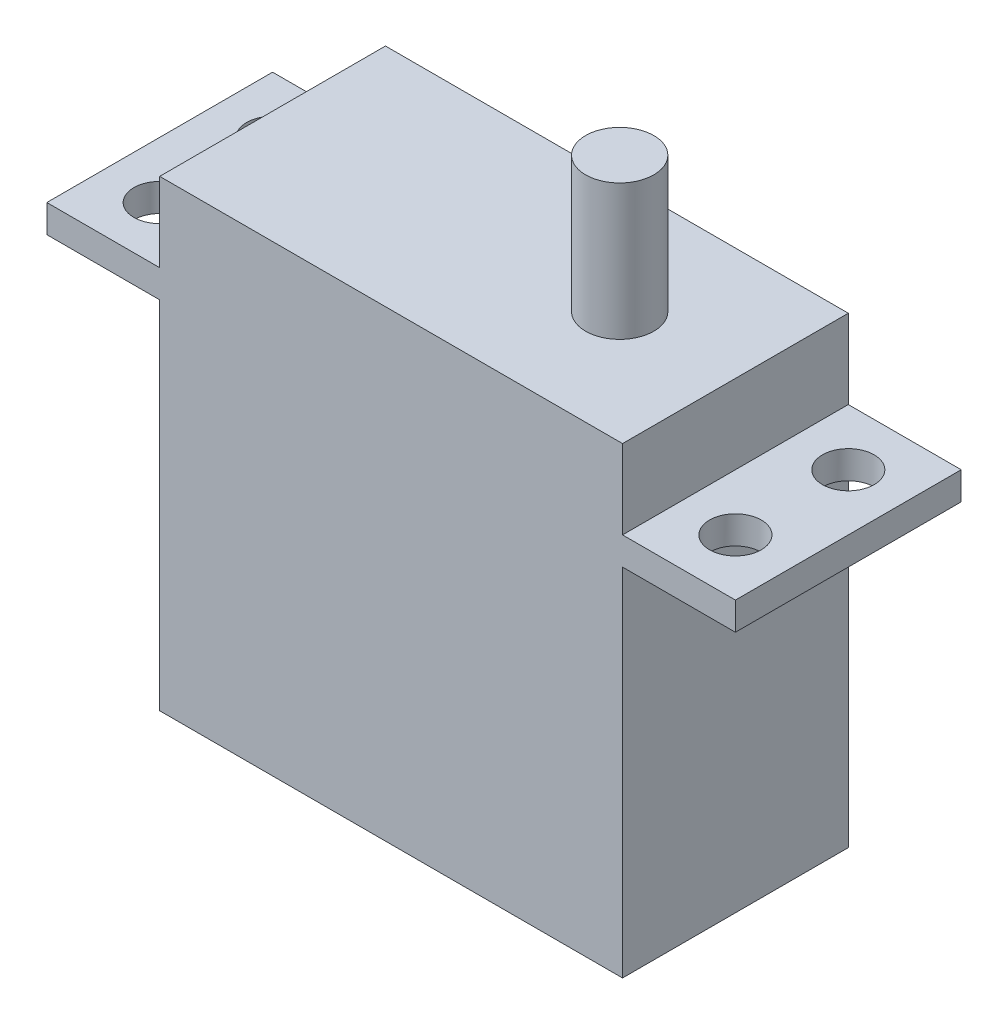
from build123d import *

# Parameters (mm, degrees)
SKETCH1_W           = 20.5
SKETCH1_H           = 20
BOSS_EXTRUDE1_DEPTH = 41
SKETCH3_W           = 20
SKETCH3_H           = 2.467931734
BOSS_EXTRUDE2_DEPTH = 10
SKETCH4_R           = 2.290313936
CUT_EXTRUDE9_DEPTH  = 10
SKETCH5_R           = 3.018718549
BOSS_EXTRUDE3_DEPTH = 12


with BuildPart() as part:
    # Sketch1 → Boss-Extrude1 (new body)
    with BuildSketch(Plane(origin=(0, 0, 0), x_dir=(1, 0, 0), z_dir=(0, 1, 0))):
        Rectangle(SKETCH1_W, SKETCH1_H)
    boss_extrude1 = extrude(amount=BOSS_EXTRUDE1_DEPTH)

    # Sketch3 → Boss-Extrude2 (add)
    with BuildSketch(Plane.ZY.offset(10.25)):
        with Locations((0, 32.759182637)):
            Rectangle(SKETCH3_W, SKETCH3_H)
    boss_extrude2 = extrude(amount=BOSS_EXTRUDE2_DEPTH)

    # Sketch4 → Cut-Extrude9 (cut)
    with BuildSketch(Plane(origin=(0, 33.993148504, 0), x_dir=(1, 0, 0), z_dir=(0, 1, 0))):
        with Locations(Location((-15.25, 5, 0), (0, 0, 270))):
            Circle(SKETCH4_R)
        with Locations(Location((-15.25, -5, 0), (0, 0, 270))):
            Circle(SKETCH4_R)
    cut_extrude9 = extrude(amount=-CUT_EXTRUDE9_DEPTH, mode=Mode.SUBTRACT)

    # Mirror1: Boss-Extrude1, Boss-Extrude2, Cut-Extrude9 across plane
    add(boss_extrude1.mirror(Plane(origin=(10.25, 41, -10), x_dir=(0, 0, 1), z_dir=(-1, 0, 0))))
    add(boss_extrude2.mirror(Plane(origin=(10.25, 41, -10), x_dir=(0, 0, 1), z_dir=(-1, 0, 0))))
    add(cut_extrude9.mirror(Plane(origin=(10.25, 41, -10), x_dir=(0, 0, 1), z_dir=(-1, 0, 0))), mode=Mode.SUBTRACT)

    # Sketch5 → Boss-Extrude3 (add)
    with BuildSketch(Plane(origin=(0, 41, 0), x_dir=(1, 0, 0), z_dir=(0, 1, 0))):
        with Locations(Location((20.5, 0, 0), (0, 0, 270))):
            Circle(SKETCH5_R)
    extrude(amount=BOSS_EXTRUDE3_DEPTH)


solid = part.part
